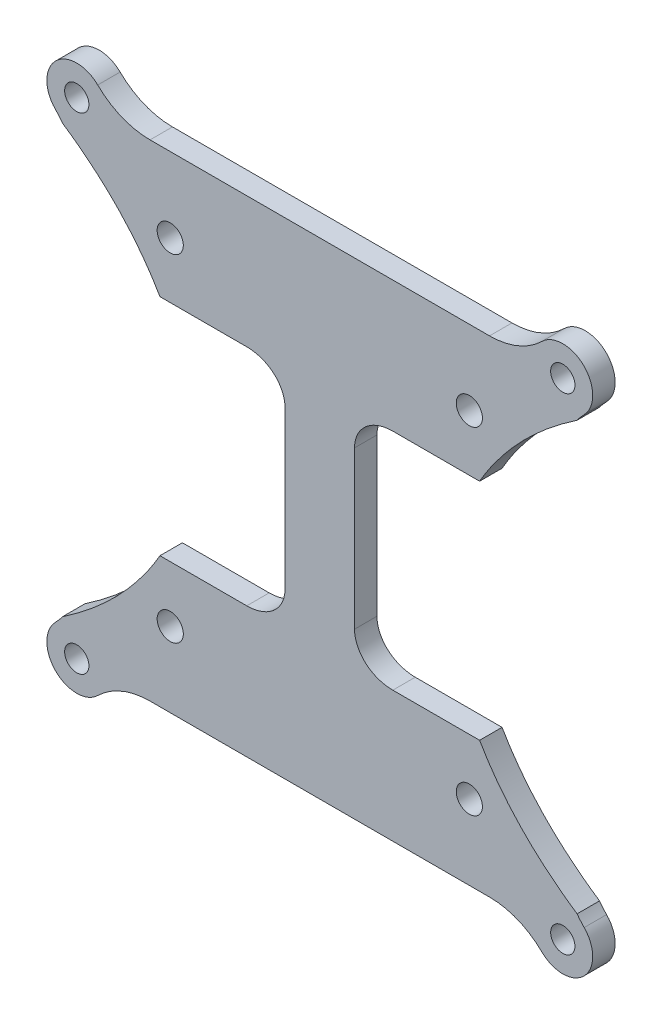
from build123d import *

# Parameters (mm, degrees)
SKETCH_1_R          = 1.625
EXTRUDE_1_DEPTH     = 3
FILLET_1_R          = 10
SKETCH_2_R          = 1.75
CUT_EXTRUDE_1_DEPTH = 10
CUT_EXTRUDE_2_DEPTH = 10


with BuildPart() as part:
    # Эскиз1 → Бобышка-Вытянуть1 (new body)
    with BuildSketch(Plane.XY):
        with BuildLine():
            ThreePointArc((-32.5, -28.5), (-35.328427125, -35.328427125), (-28.5, -32.5))
            Line((-28.5, -32.5), (28.5, -32.5))
            ThreePointArc((28.5, -32.5), (35.328427125, -35.328427125), (32.5, -28.5))
            Line((32.5, -28.5), (32.5, 28.5))
            ThreePointArc((32.5, 28.5), (35.328427125, 35.328427125), (28.5, 32.5))
            Line((28.5, 32.5), (-28.5, 32.5))
            ThreePointArc((-28.5, 32.5), (-35.328427125, 35.328427125), (-32.5, 28.5))
            Line((-32.5, 28.5), (-32.5, -28.5))
        make_face()
        with Locations((-32.5, -32.5)):
            Circle(SKETCH_1_R, mode=Mode.SUBTRACT)
        with Locations((32.5, 32.5)):
            Circle(SKETCH_1_R, mode=Mode.SUBTRACT)
        with Locations((-32.5, 32.5)):
            Circle(SKETCH_1_R, mode=Mode.SUBTRACT)
        with Locations((32.5, -32.5)):
            Circle(SKETCH_1_R, mode=Mode.SUBTRACT)
    extrude(amount=EXTRUDE_1_DEPTH)

    # Скругление1
    fillet_1_edges = [part.edges().sort_by_distance(p)[0] for p in [
        (-32.5, -28.5, 1.5),
        (-32.5, 28.5, 1.5),
        (-28.5, 32.5, 1.5),
        (28.5, 32.5, 1.5),
        (32.5, 28.5, 1.5),
        (32.5, -28.5, 1.5),
        (28.5, -32.5, 1.5),
        (-28.5, -32.5, 1.5),
    ]]
    fillet(fillet_1_edges, radius=FILLET_1_R)

    # Эскиз2 → Вырез-Вытянуть1 (cut)
    with BuildSketch(Plane.XY.offset(3)):
        with Locations((-20, 22.5)):
            Circle(SKETCH_2_R)
        with Locations((20, 22.5)):
            Circle(SKETCH_2_R)
        with Locations((20, -22.5)):
            Circle(SKETCH_2_R)
        with Locations((-20, -22.5)):
            Circle(SKETCH_2_R)
    extrude(amount=-CUT_EXTRUDE_1_DEPTH, mode=Mode.SUBTRACT)

    # Эскиз3 → Вырез-Вытянуть2 (cut)
    with BuildSketch(Plane.XY.offset(3)):
        with BuildLine():
            add(Edge.make_bspline(
                [(-32.527489894, -23.443014841), (-28.375728829, -20.018024812), (-25.244554374, -16.149809022), (-23.169847522, -12)],
                knots=[0.670058252, 0.670058252, 0.670058252, 0.670058252, 1, 1, 1, 1], degree=3, weights=[0.931160573, 0.942808031, 0.965754506, 1]))
            ThreePointArc((-32.527489894, -23.443014841), (-33.111489843, -26.145277446), (-34.413079829, -28.584363881))
            add(Edge.make_bspline(
                [(-34.413079829, -28.584363881), (-34.162781762, -28.415899337), (-32.110993648, -27.008206413), (-28.554552568, -24.147931842), (-25.112994349, -20.465265714), (-22.816100456, -17.367890887), (-21.837559693, -15.807591474), (-21.375246541, -15)],
                knots=[0.582328212, 0.582328212, 0.582328212, 0.582328212, 0.598815147, 0.718707852, 0.838600557, 0.89854691, 0.958493262, 0.958493262, 0.958493262, 0.958493262], degree=3))
            Line((-21.375246541, -15), (-9.767766953, -15))
            add(Edge.make_bspline(
                [(-9.767766953, -15), (-9.508808337, -15), (-9.003254917, -14.968962036), (-7.906330267, -14.751989256), (-6.499735229, -14.141611525), (-5.02770668, -12.620388587), (-4.646446609, -11.195491949), (-4.646446609, -10.5)],
                knots=[0, 0, 0, 0, 0.125, 0.25, 0.5, 0.75, 1, 1, 1, 1], degree=3))
            Line((-4.646446609, -10.5), (-4.646446609, 10.5))
            add(Edge.make_bspline(
                [(-4.646446609, 10.5), (-4.646446609, 11.195491949), (-5.02770668, 12.620388587), (-6.499735229, 14.141611525), (-7.906330267, 14.751989256), (-9.003254917, 14.968962036), (-9.508808337, 15), (-9.767766953, 15)],
                knots=[0, 0, 0, 0, 0.25, 0.5, 0.75, 0.875, 1, 1, 1, 1], degree=3))
            Line((-9.767766953, 15), (-21.37524486, 15))
            add(Edge.make_bspline(
                [(-21.37524486, 15), (-21.837239216, 15.807035997), (-22.815069156, 17.366298535), (-25.110083863, 20.461647473), (-28.548537123, 24.142096322), (-32.105125, 27.003841781), (-34.15908814, 28.413423233), (-34.413093524, 28.58438271)],
                knots=[0.041506851, 0.041506851, 0.041506851, 0.041506851, 0.101412672, 0.161318494, 0.281130138, 0.400941782, 0.417672945, 0.417672945, 0.417672945, 0.417672945], degree=3))
            ThreePointArc((-34.413093524, 28.58438271), (-33.111495685, 26.145293377), (-32.527490684, 23.443025466))
            add(Edge.make_bspline(
                [(-23.169847522, 12), (-25.244551608, 16.149812881), (-28.375726398, 20.018032487), (-32.527490684, 23.443025466)],
                knots=[0, 0, 0, 0, 0.329942503, 0.329942503, 0.329942503, 0.329942503], degree=3, weights=[1, 0.965754428, 0.942807926, 0.931160493]))
            Line((-23.169847522, 12), (-9.767766953, 12))
            add(Edge.make_bspline(
                [(-7.646446609, 10.5), (-7.646446609, 11.378679656), (-8.525126266, 12), (-9.767766953, 12)],
                knots=[0, 0, 0, 0, 1, 1, 1, 1], degree=3, weights=[1, 0.804737854, 0.804737854, 1]))
            Line((-7.646446609, 10.5), (-7.646446609, -10.5))
            add(Edge.make_bspline(
                [(-9.767766953, -12), (-8.525126266, -12), (-7.646446609, -11.378679656), (-7.646446609, -10.5)],
                knots=[0, 0, 0, 0, 1, 1, 1, 1], degree=3, weights=[1, 0.804737854, 0.804737854, 1]))
            Line((-9.767766953, -12), (-23.169847522, -12))
        make_face()
        with BuildLine():
            ThreePointArc((32.52748995, 23.443015585), (33.111490075, 26.145278078), (34.413080182, 28.584364367))
            add(Edge.make_bspline(
                [(34.413080182, 28.584364367), (34.159090219, 28.413415142), (32.105139192, 27.003842637), (28.548557361, 24.142106491), (25.110095557, 20.461653929), (22.815074777, 17.366301448), (21.837242114, 15.807037015), (21.375246423, 15)],
                knots=[0.582328153, 0.582328153, 0.582328153, 0.582328153, 0.599058284, 0.718869941, 0.838681597, 0.898587426, 0.958493254, 0.958493254, 0.958493254, 0.958493254], degree=3))
            Line((21.375246423, 15), (9.767766953, 15))
            add(Edge.make_bspline(
                [(9.767766953, 15), (9.508808337, 15), (9.003254917, 14.968962036), (7.906330267, 14.751989256), (6.499735229, 14.141611525), (5.02770668, 12.620388587), (4.646446609, 11.195491949), (4.646446609, 10.5)],
                knots=[0, 0, 0, 0, 0.125, 0.25, 0.5, 0.75, 1, 1, 1, 1], degree=3))
            Line((4.646446609, 10.5), (4.646446609, -10.5))
            add(Edge.make_bspline(
                [(4.646446609, -10.5), (4.646446609, -11.195491949), (5.02770668, -12.620388587), (6.499735229, -14.141611525), (7.906330267, -14.751989256), (9.003254917, -14.968962036), (9.508808337, -15), (9.767766953, -15)],
                knots=[0, 0, 0, 0, 0.25, 0.5, 0.75, 0.875, 1, 1, 1, 1], degree=3))
            Line((9.767766953, -15), (21.375247121, -15))
            add(Edge.make_bspline(
                [(21.375247121, -15), (21.837243275, -15.807037373), (22.815076886, -17.366302473), (25.110099787, -20.461656203), (28.54856459, -24.142110079), (32.105144234, -27.003842899), (34.159090929, -28.413412213), (34.413075391, -28.58435778)],
                knots=[0.041506699, 0.041506699, 0.041506699, 0.041506699, 0.10141253, 0.161318362, 0.281130024, 0.400941687, 0.41767145, 0.41767145, 0.41767145, 0.41767145], degree=3))
            ThreePointArc((34.413075391, -28.58435778), (33.111487911, -26.14527218), (32.527489622, -23.443011177))
            add(Edge.make_bspline(
                [(23.169847522, -12), (25.244555327, -16.149807692), (28.375729667, -20.018022166), (32.527489622, -23.443011177)],
                knots=[0, 0, 0, 0, 0.329941488, 0.329941488, 0.329941488, 0.329941488], degree=3, weights=[1, 0.965754533, 0.942808067, 0.9311606]))
            Line((23.169847522, -12), (9.767766953, -12))
            add(Edge.make_bspline(
                [(7.646446609, -10.5), (7.646446609, -11.378679656), (8.525126266, -12), (9.767766953, -12)],
                knots=[0, 0, 0, 0, 1, 1, 1, 1], degree=3, weights=[1, 0.804737854, 0.804737854, 1]))
            Line((7.646446609, -10.5), (7.646446609, 10.5))
            add(Edge.make_bspline(
                [(9.767766953, 12), (8.525126266, 12), (7.646446609, 11.378679656), (7.646446609, 10.5)],
                knots=[0, 0, 0, 0, 1, 1, 1, 1], degree=3, weights=[1, 0.804737854, 0.804737854, 1]))
            Line((9.767766953, 12), (23.169847522, 12))
            add(Edge.make_bspline(
                [(32.52748995, 23.443015585), (28.375728659, 20.01802535), (25.24455418, 16.149809293), (23.169847522, 12)],
                knots=[0.670058199, 0.670058199, 0.670058199, 0.670058199, 1, 1, 1, 1], degree=3, weights=[0.931160567, 0.942808023, 0.965754501, 1]))
        make_face()
    extrude(amount=-CUT_EXTRUDE_2_DEPTH, mode=Mode.SUBTRACT)


with BuildPart() as cut_extrude_2_kept_piece:
    # of the separate pieces the step leaves, the one the design keeps (cut_extrude_2_pieces_kept)
    add(part.part.solids().sort_by_distance((-34.413093524, 28.58438271, 0))[0])


solid = cut_extrude_2_kept_piece.part
